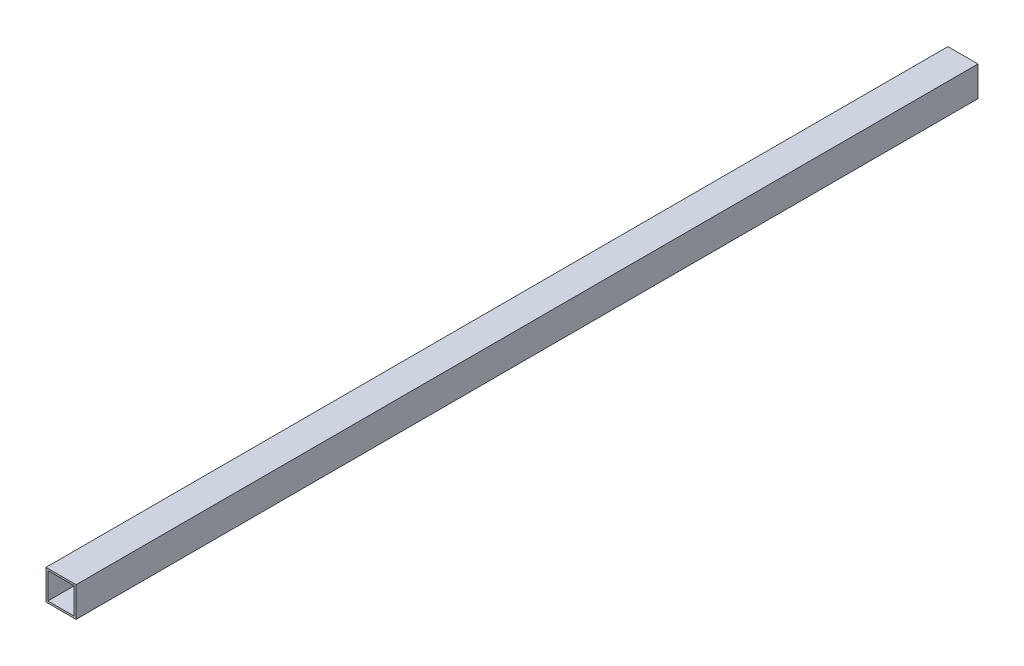
from build123d import *

# Parameters (mm, degrees)
SKETCH1_W           = 50.8
SKETCH1_H           = 50.8
SKETCH1_W_2         = 44.45
SKETCH1_H_2         = 44.45
BOSS_EXTRUDE1_DEPTH = 1524


with BuildPart() as part:
    # Sketch1 → Boss-Extrude1 (new body)
    with BuildSketch(Plane.XY):
        Rectangle(SKETCH1_W, SKETCH1_H)
        Rectangle(SKETCH1_W_2, SKETCH1_H_2, mode=Mode.SUBTRACT)
    extrude(amount=BOSS_EXTRUDE1_DEPTH)


solid = part.part
